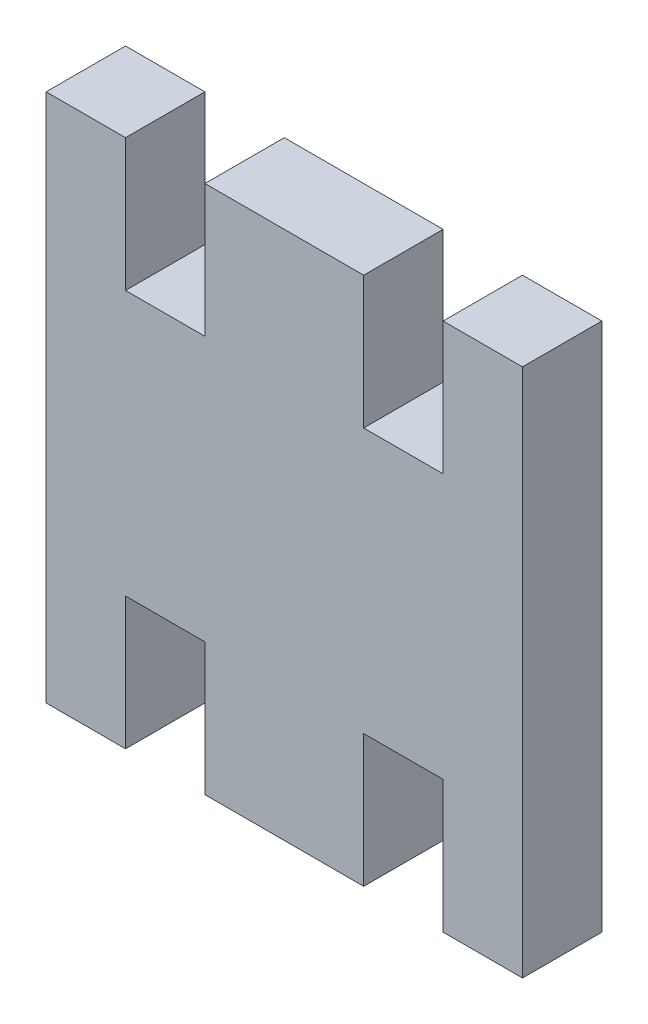
from build123d import *

# Parameters (mm, degrees)
SKETCH1_W            = 36
SKETCH1_H            = 40
BOSS_EXTRUDE1_DEPTH  = 6
SKETCH2_W            = 6
SKETCH2_H            = 10
CUT_EXTRUDE1_DEPTH   = 55.147945483
LPATTERN1_COUNT      = 2
LPATTERN1_PITCH      = 18
LPATTERN1_COUNT_DIR2 = 2
LPATTERN1_PITCH_DIR2 = 30


with BuildPart() as part:
    # Sketch1 → Boss-Extrude1 (new body)
    with BuildSketch(Plane.XY):
        with Locations((-18, 20)):
            Rectangle(SKETCH1_W, SKETCH1_H)
    extrude(amount=BOSS_EXTRUDE1_DEPTH)

    # Sketch2 → Cut-Extrude1 (cut, through all)
    with BuildSketch(Plane.XY.offset(6)):
        with Locations((-27, 35)):
            Rectangle(SKETCH2_W, SKETCH2_H)
    cut_extrude1 = extrude(amount=-CUT_EXTRUDE1_DEPTH, mode=Mode.SUBTRACT)

    # LPattern1: Cut-Extrude1 2 × 2
    with Locations(*[(i * LPATTERN1_PITCH, -j * LPATTERN1_PITCH_DIR2, 0) for i in range(LPATTERN1_COUNT) for j in range(LPATTERN1_COUNT_DIR2) if (i, j) != (0, 0)]):
        add(cut_extrude1, mode=Mode.SUBTRACT)


solid = part.part
